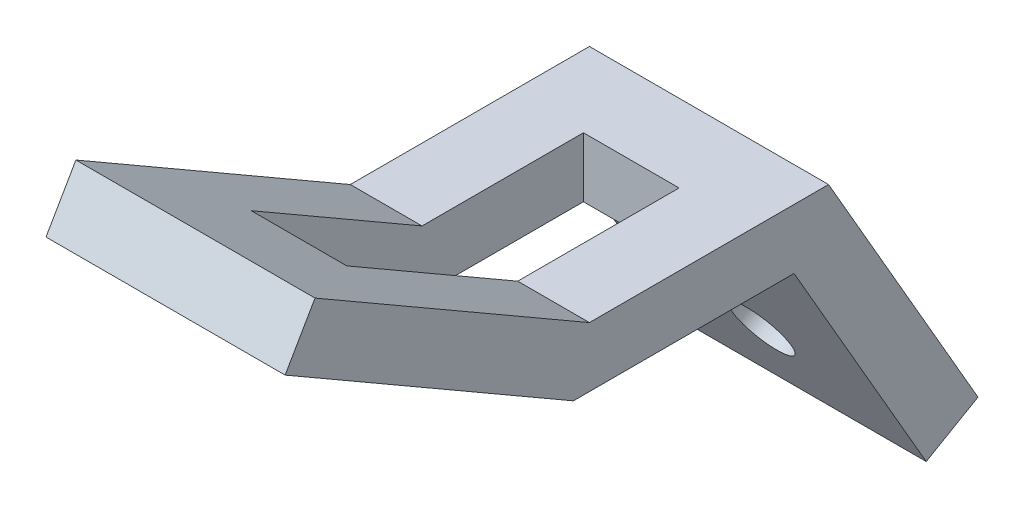
from build123d import *

# Parameters (mm, degrees)
BOSS_EXTRUDE1_DEPTH = 40
CUT_EXTRUDE1_REACH  = 143.085
SKETCH2_R           = 5
CUT_EXTRUDE2_REACH  = 138.298
SKETCH3_W           = 16
SKETCH3_H           = 33
SKETCH4_W           = 16
SKETCH4_H           = 32
CUT_EXTRUDE4_DEPTH  = 40


with BuildPart() as part:
    # Sketch1 → Boss-Extrude1 (new body)
    with BuildSketch(Plane(origin=(0, 0, 0), x_dir=(0, 0, -1), z_dir=(1, 0, 0))):
        Polygon((-102.239092363, 74.801270189), (-107.239092363, 66.141016151), (-59.019237886, 38.301270189), (-22.113248654, 38.301270189), (0, 0), (8.660254038, 5), (-16.339745962, 48.301270189), (-56.339745962, 48.301270189), align=None)
    extrude(amount=BOSS_EXTRUDE1_DEPTH)

    # Sketch2 → Cut-Extrude1 (cut, up to next)
    with BuildSketch(Plane(origin=(0, 5, -8.660254038), x_dir=(-1, 0, 0), z_dir=(0, 0.4999999999999983, -0.8660254037844396)), mode=Mode.PRIVATE) as cut_extrude1_sk1:
        with Locations((-20, 35)):
            Circle(SKETCH2_R)
    cut_extrude1_tool1 = extrude(cut_extrude1_sk1.sketch, amount=-CUT_EXTRUDE1_REACH, mode=Mode.PRIVATE) & part.part
    # Sketch2 → Cut-Extrude1 (cut, up to next)
    with BuildSketch(Plane(origin=(0, 5, -8.660254038), x_dir=(-1, 0, 0), z_dir=(0, 0.4999999999999983, -0.8660254037844396)), mode=Mode.PRIVATE) as cut_extrude1_sk2:
        with Locations((-20, 15)):
            Circle(SKETCH2_R)
    cut_extrude1_tool2 = extrude(cut_extrude1_sk2.sketch, amount=-CUT_EXTRUDE1_REACH, mode=Mode.PRIVATE) & part.part
    add(cut_extrude1_tool1.solids().sort_by_distance((20, 35.310889, 8.839746))[0], mode=Mode.SUBTRACT)
    add(cut_extrude1_tool2.solids().sort_by_distance((20, 17.990381, -1.160254))[0], mode=Mode.SUBTRACT)

    # Sketch3 → Cut-Extrude2 (cut, up to next)
    with BuildSketch(Plane(origin=(0, 11.830127019, -6.830127019), x_dir=(1, 0, 0), z_dir=(0, 0.8660254037844383, -0.5000000000000009)), mode=Mode.PRIVATE) as cut_extrude2_sk1:
        with Locations((20, -89.442286341)):
            Rectangle(SKETCH3_W, SKETCH3_H)
    cut_extrude2_tool1 = extrude(cut_extrude2_sk1.sketch, amount=-CUT_EXTRUDE2_REACH, mode=Mode.PRIVATE) & part.part
    add(cut_extrude2_tool1.solids().sort_by_distance((20, 56.55127, 70.629165))[0], mode=Mode.SUBTRACT)

    # Sketch4 → Cut-Extrude4 (cut)
    with BuildSketch(Plane(origin=(0, 48.301270189, 0), x_dir=(1, 0, 0), z_dir=(0, 1, 0))):
        with Locations((20, -45.339745962)):
            Rectangle(SKETCH4_W, SKETCH4_H)
    extrude(amount=-CUT_EXTRUDE4_DEPTH, mode=Mode.SUBTRACT)


solid = part.part
